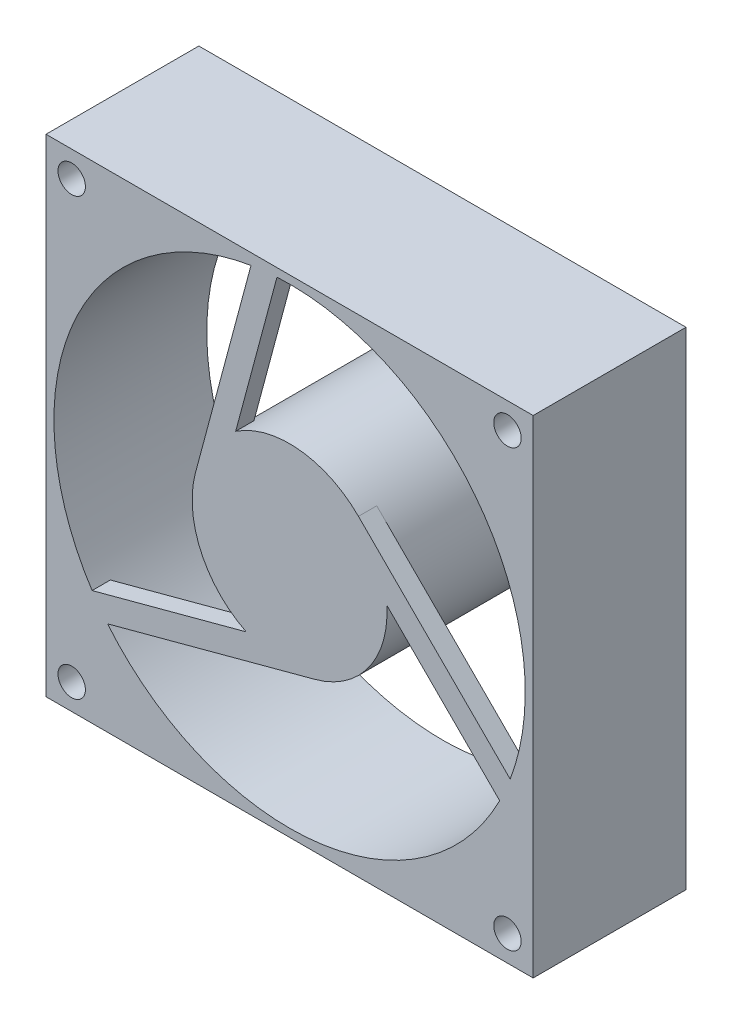
from build123d import *

# Parameters (mm, degrees)
SKETCH1_W             = 80
SKETCH1_H             = 80
SKETCH1_R             = 38.7
SKETCH1_R_2           = 2.25
BOSS_EXTRUDE1_DEPTH   = 12.55
SKETCH1_R_3           = 16
BOSS_EXTRUDE1_2_DEPTH = 12.55
BOSS_EXTRUDE2_START   = -3
BOSS_EXTRUDE2_DEPTH   = 3
CIRPATTERN1_COUNT     = 3


with BuildPart() as part:
    # Sketch1 → Boss-Extrude1 (new, symmetric)
    with BuildSketch(Plane.XY):
        Rectangle(SKETCH1_W, SKETCH1_H)
        Circle(SKETCH1_R, mode=Mode.SUBTRACT)
        with Locations((-35.779603128, -35.779603128)):
            Circle(SKETCH1_R_2, mode=Mode.SUBTRACT)
        with Locations((35.779603128, -35.779603128)):
            Circle(SKETCH1_R_2, mode=Mode.SUBTRACT)
        with Locations((35.779603128, 35.779603128)):
            Circle(SKETCH1_R_2, mode=Mode.SUBTRACT)
        with Locations((-35.779603128, 35.779603128)):
            Circle(SKETCH1_R_2, mode=Mode.SUBTRACT)
    extrude(amount=BOSS_EXTRUDE1_DEPTH, both=True)



with BuildPart() as body_2:
    # Sketch1 → Boss-Extrude1 2 (new, symmetric)
    with BuildSketch(Plane.XY):
        Circle(SKETCH1_R_3)
    extrude(amount=BOSS_EXTRUDE1_2_DEPTH, both=True)


with BuildPart() as part_1:
    add(part.part)

    add(body_2.part)  # Boss-Extrude2 merges body 2
    # Sketch2 → Boss-Extrude2 (add)
    with BuildSketch(Plane.XY.offset(12.55).offset(BOSS_EXTRUDE2_START)):
        with BuildLine():
            Line((-15.454813221, 4.141104722), (-6.334645558, 38.178033811))
            ThreePointArc((-6.334645558, 38.178033811), (-4.208047958, 38.470538499), (-2.068503362, 38.64468002))
            Line((-2.068503362, 38.64468002), (-8.852026604, 13.328226626))
            ThreePointArc((-8.852026604, 13.328226626), (-12.992552397, 9.337750383), (-15.454813221, 4.141104722))
        make_face()
    boss_extrude2 = extrude(amount=BOSS_EXTRUDE2_DEPTH)

    # CirPattern1: Boss-Extrude2 ×3 about axis
    cirpattern1_axis = Axis((0, 0, 0), (0, 0, 1))
    for i in range(1, CIRPATTERN1_COUNT):
        add(boss_extrude2.rotate(cirpattern1_axis, i * 360 / CIRPATTERN1_COUNT))


solid = part_1.part
